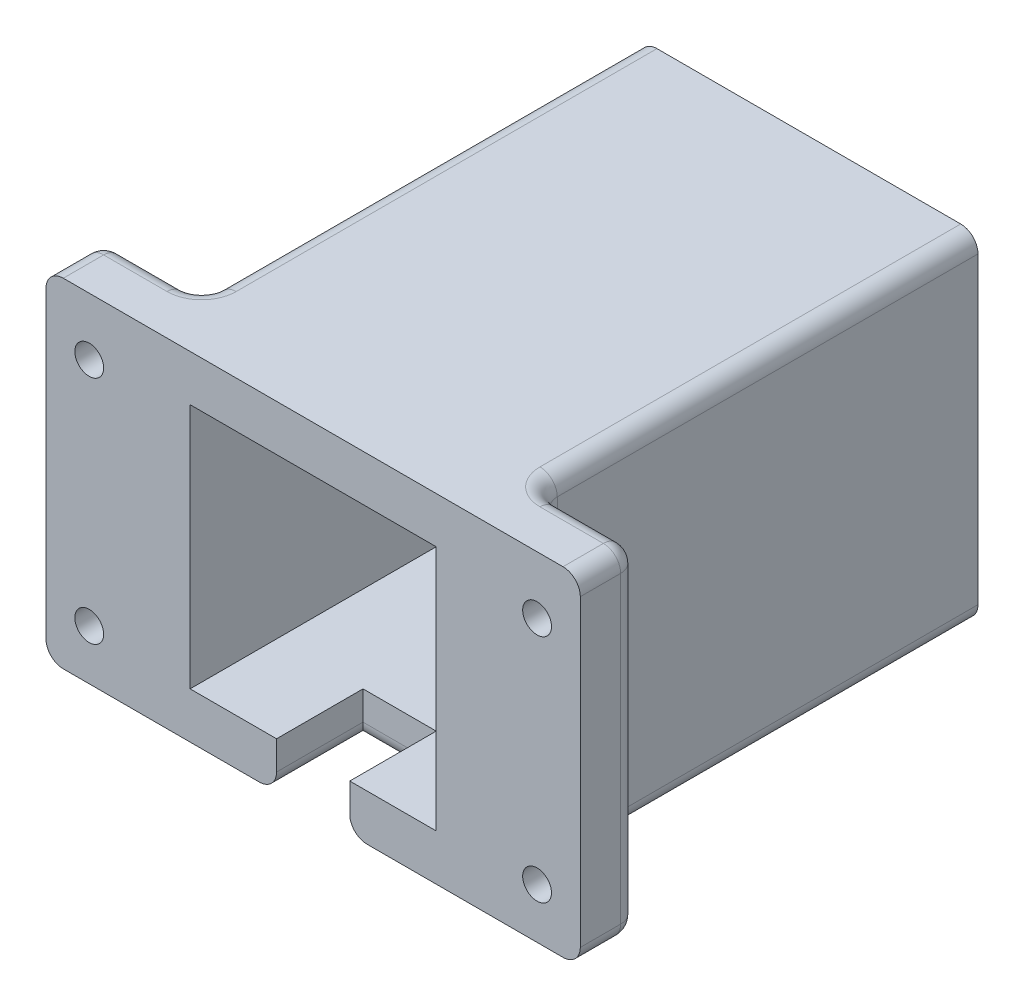
from build123d import *

# Parameters (mm, degrees)
CROQUIS1_W              = 58.7
CROQUIS1_H              = 58.7
SALIENTE_EXTRUIR1_DEPTH = 86
CROQUIS2_W              = 42.7
CROQUIS2_H              = 42.7
CORTAR_EXTRUIR1_DEPTH   = 53
CROQUIS3_R              = 18.5
CORTAR_EXTRUIR2_DEPTH   = 30
CROQUIS4_R              = 11.5
CORTAR_EXTRUIR3_DEPTH   = 118.389863276
CROQUIS5_R              = 1.5
CORTAR_EXTRUIR4_DEPTH   = 118.389863276
MATRIZC1_COUNT          = 4
CORTAR_EXTRUIR5_DEPTH   = 5
CROQUIS7_W              = 92.702698273
CROQUIS7_H              = 58.7
CROQUIS7_R              = 2.5
CROQUIS7_W_2            = 42.7
CROQUIS7_H_2            = 42.7
SALIENTE_EXTRUIR2_DEPTH = 10
CROQUIS9_W              = 12.7
CROQUIS9_H              = 8
CORTAR_EXTRUIR7_DEPTH   = 15
REDONDEO1_R             = 3
CORTAR_EXTRUIR8_DEPTH   = 29
CROQUIS11_R             = 1.5
CORTAR_EXTRUIR9_DEPTH   = 4


with BuildPart() as part:
    # Croquis1 → Saliente-Extruir1 (new body)
    with BuildSketch(Plane.XY):
        with Locations((29.35, 29.35)):
            Rectangle(CROQUIS1_W, CROQUIS1_H)
    extrude(amount=-SALIENTE_EXTRUIR1_DEPTH)

    # Croquis2 → Cortar-Extruir1 (cut)
    with BuildSketch(Plane.XY):
        with Locations((29.35, 29.35)):
            Rectangle(CROQUIS2_W, CROQUIS2_H)
    extrude(amount=-CORTAR_EXTRUIR1_DEPTH, mode=Mode.SUBTRACT)

    # Croquis3 → Cortar-Extruir2 (cut)
    with BuildSketch(Plane.XY.offset(-53)):
        with Locations((29.35, 29.35)):
            Circle(CROQUIS3_R)
    extrude(amount=-CORTAR_EXTRUIR2_DEPTH, mode=Mode.SUBTRACT)

    # Croquis4 → Cortar-Extruir3 (cut, through all)
    with BuildSketch(Plane.XY.offset(-83)):
        with Locations((29.35, 29.35)):
            Circle(CROQUIS4_R)
    extrude(amount=-CORTAR_EXTRUIR3_DEPTH, mode=Mode.SUBTRACT)

    # Croquis5 → Cortar-Extruir4 (cut, through all)
    with BuildSketch(Plane.XY.offset(-83)):
        with Locations((39.249494937, 39.249494937)):
            Circle(CROQUIS5_R)
    cortar_extruir4 = extrude(amount=-CORTAR_EXTRUIR4_DEPTH, mode=Mode.SUBTRACT)

    # MatrizC1: Cortar-Extruir4 ×4 about axis
    matrizc1_axis = Axis((29.35, 29.35, 0), (0, 0, 1))
    for i in range(1, MATRIZC1_COUNT):
        add(cortar_extruir4.rotate(matrizc1_axis, i * 360 / MATRIZC1_COUNT), mode=Mode.SUBTRACT)

    # Croquis6 → Cortar-Extruir5 (cut)
    with BuildSketch(Plane(origin=(0, 0, -86), x_dir=(-1, 0, 0), z_dir=(0, 0, -1))):
        with BuildLine():
            ThreePointArc((-29.35, 53.35), (-30.35, 52.35), (-29.35, 51.35))
            Line((-29.35, 51.35), (-29.35, 53.35))
        make_face()
        with BuildLine():
            Line((-29.35, 53.35), (-29.35, 51.35))
            ThreePointArc((-29.35, 51.35), (-28.642893219, 51.642893219), (-28.35, 52.35))
            ThreePointArc((-28.35, 52.35), (-28.642893219, 53.057106781), (-29.35, 53.35))
        make_face()
        with BuildLine():
            ThreePointArc((-29.35, 46.6), (-30.35, 45.6), (-29.35, 44.6))
            Line((-29.35, 44.6), (-29.35, 46.6))
        make_face()
        with BuildLine():
            Line((-29.35, 46.6), (-29.35, 44.6))
            ThreePointArc((-29.35, 44.6), (-28.642893219, 44.892893219), (-28.35, 45.6))
            ThreePointArc((-28.35, 45.6), (-28.642893219, 46.307106781), (-29.35, 46.6))
        make_face()
        with BuildLine():
            ThreePointArc((-29.35, 14.1), (-30.35, 13.1), (-29.35, 12.1))
            Line((-29.35, 12.1), (-29.35, 14.1))
        make_face()
        with BuildLine():
            Line((-29.35, 14.1), (-29.35, 12.1))
            ThreePointArc((-29.35, 12.1), (-28.642893219, 12.392893219), (-28.35, 13.1))
            ThreePointArc((-28.35, 13.1), (-28.642893219, 13.807106781), (-29.35, 14.1))
        make_face()
        with BuildLine():
            ThreePointArc((-29.35, 7.35), (-30.35, 6.35), (-29.35, 5.35))
            Line((-29.35, 5.35), (-29.35, 7.35))
        make_face()
        with BuildLine():
            Line((-29.35, 7.35), (-29.35, 5.35))
            ThreePointArc((-29.35, 5.35), (-28.642893219, 5.642893219), (-28.35, 6.35))
            ThreePointArc((-28.35, 6.35), (-28.642893219, 7.057106781), (-29.35, 7.35))
        make_face()
    extrude(amount=-CORTAR_EXTRUIR5_DEPTH, mode=Mode.SUBTRACT)

    # Croquis7 → Saliente-Extruir2 (add)
    with BuildSketch(Plane.XY):
        with Locations((29.348650864, 29.35)):
            Rectangle(CROQUIS7_W, CROQUIS7_H)
        with Locations((-9.502698273, 48.7)):
            Circle(CROQUIS7_R, mode=Mode.SUBTRACT)
        with Locations((68.2, 48.7)):
            Circle(CROQUIS7_R, mode=Mode.SUBTRACT)
        with Locations((-9.502698273, 8.7)):
            Circle(CROQUIS7_R, mode=Mode.SUBTRACT)
        with Locations((68.2, 8.7)):
            Circle(CROQUIS7_R, mode=Mode.SUBTRACT)
        with Locations((29.35, 29.35)):
            Rectangle(CROQUIS7_W_2, CROQUIS7_H_2, mode=Mode.SUBTRACT)
    extrude(amount=-SALIENTE_EXTRUIR2_DEPTH)

    # Croquis9 → Cortar-Extruir7 (cut)
    with BuildSketch(Plane.XY):
        with Locations((29.35, 4)):
            Rectangle(CROQUIS9_W, CROQUIS9_H)
    extrude(amount=-CORTAR_EXTRUIR7_DEPTH, mode=Mode.SUBTRACT)

    # Redondeo1
    redondeo1_edges = [part.edges().sort_by_distance(p)[0] for p in [
        (0, 0, -48),
        (23, 0, -7.5),
        (29.35, 0, -15),
        (35.7, 0, -7.5),
        (-8.501349137, 58.7, -10),
        (-17.002698273, 58.7, -5),
        (-8.501349137, 0, -10),
        (0, 29.35, -10),
        (58.7, 29.35, -10),
        (-17.002698273, 29.35, -10),
        (0, 58.7, -48),
        (-17.002698273, 0, -5),
        (67.2, 58.7, -10),
        (75.7, 29.35, -10),
        (58.7, 58.7, -48),
        (75.7, 58.7, -5),
        (67.2, 0, -10),
        (75.7, 0, -5),
        (58.7, 0, -48),
    ]]
    fillet(redondeo1_edges, radius=REDONDEO1_R)

    # Croquis10 → Cortar-Extruir8 (cut)
    with BuildSketch(Plane(origin=(0, 0, -86), x_dir=(-1, 0, 0), z_dir=(0, 0, -1))):
        with BuildLine():
            ThreePointArc((-41.85, 44.85), (-46.971320344, 46.971320344), (-44.85, 41.85))
            Line((-44.85, 41.85), (-44.85, 44.85))
            Line((-44.85, 44.85), (-41.85, 44.85))
        make_face()
        with BuildLine():
            Line((-44.85, 44.85), (-44.85, 41.85))
            ThreePointArc((-44.85, 41.85), (-42.728679656, 42.728679656), (-41.85, 44.85))
            Line((-41.85, 44.85), (-44.85, 44.85))
        make_face()
        with BuildLine():
            ThreePointArc((-16.85, 44.85), (-15.971320344, 42.728679656), (-13.85, 41.85))
            Line((-13.85, 41.85), (-13.85, 44.85))
            Line((-13.85, 44.85), (-16.85, 44.85))
        make_face()
        with BuildLine():
            Line((-13.85, 44.85), (-13.85, 41.85))
            ThreePointArc((-13.85, 41.85), (-11.728679656, 42.728679656), (-10.85, 44.85))
            ThreePointArc((-10.85, 44.85), (-13.85, 47.85), (-16.85, 44.85))
            Line((-16.85, 44.85), (-13.85, 44.85))
        make_face()
        with BuildLine():
            ThreePointArc((-13.85, 16.85), (-15.971320344, 15.971320344), (-16.85, 13.85))
            Line((-16.85, 13.85), (-13.85, 13.85))
            Line((-13.85, 13.85), (-13.85, 16.85))
        make_face()
        with BuildLine():
            Line((-13.85, 13.85), (-16.85, 13.85))
            ThreePointArc((-16.85, 13.85), (-13.85, 10.85), (-10.85, 13.85))
            ThreePointArc((-10.85, 13.85), (-11.728679656, 15.971320344), (-13.85, 16.85))
            Line((-13.85, 16.85), (-13.85, 13.85))
        make_face()
        with BuildLine():
            Line((-44.85, 16.85), (-44.85, 13.85))
            Line((-44.85, 13.85), (-41.85, 13.85))
            ThreePointArc((-41.85, 13.85), (-42.728679656, 15.971320344), (-44.85, 16.85))
        make_face()
        with BuildLine():
            Line((-41.85, 13.85), (-44.85, 13.85))
            Line((-44.85, 13.85), (-44.85, 16.85))
            ThreePointArc((-44.85, 16.85), (-46.971320344, 11.728679656), (-41.85, 13.85))
        make_face()
    extrude(amount=-CORTAR_EXTRUIR8_DEPTH, mode=Mode.SUBTRACT)

    # Croquis11 → Cortar-Extruir9 (cut)
    with BuildSketch(Plane(origin=(0, 0, -57), x_dir=(-1, 0, 0), z_dir=(0, 0, -1))):
        with Locations((-44.85, 44.85)):
            Circle(CROQUIS11_R)
        with Locations((-13.85, 44.85)):
            Circle(CROQUIS11_R)
        with Locations((-13.85, 13.85)):
            Circle(CROQUIS11_R)
        with Locations((-44.85, 13.85)):
            Circle(CROQUIS11_R)
    extrude(amount=-CORTAR_EXTRUIR9_DEPTH, mode=Mode.SUBTRACT)


solid = part.part
